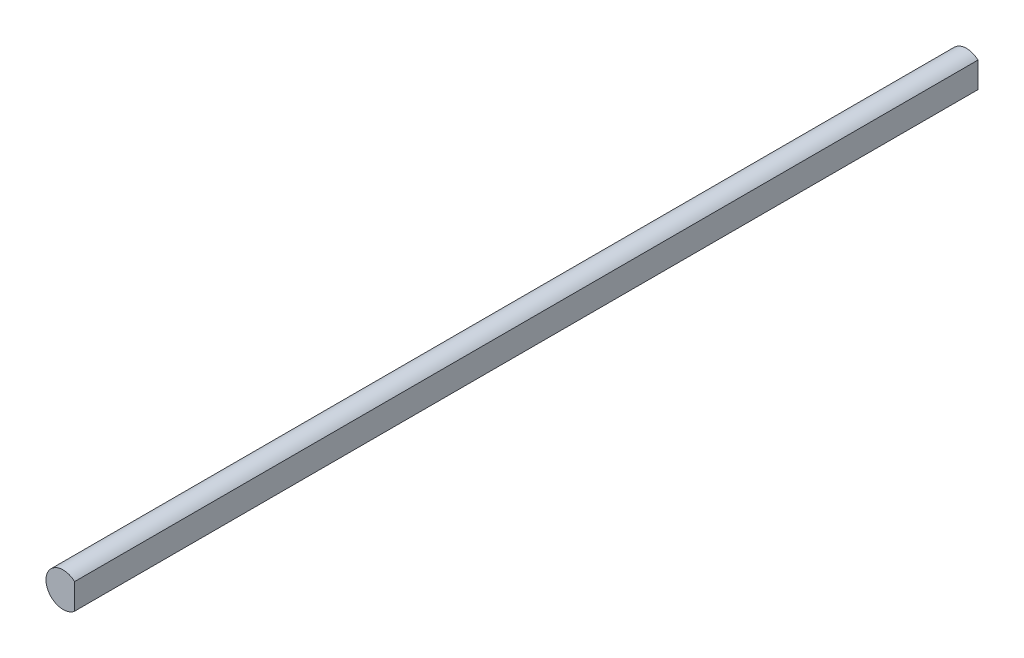
from build123d import *

# Parameters (mm, degrees)
EXTRUDE_1_DEPTH = 78.8


with BuildPart() as part:
    # 草图1 → 凸台-拉伸1 (new body)
    with BuildSketch(Plane.XY):
        with BuildLine():
            Line((1, -1.118033989), (1, 1.118033989))
            ThreePointArc((1, 1.118033989), (-1.5, 0), (1, -1.118033989))
        make_face()
    extrude(amount=EXTRUDE_1_DEPTH)


solid = part.part
